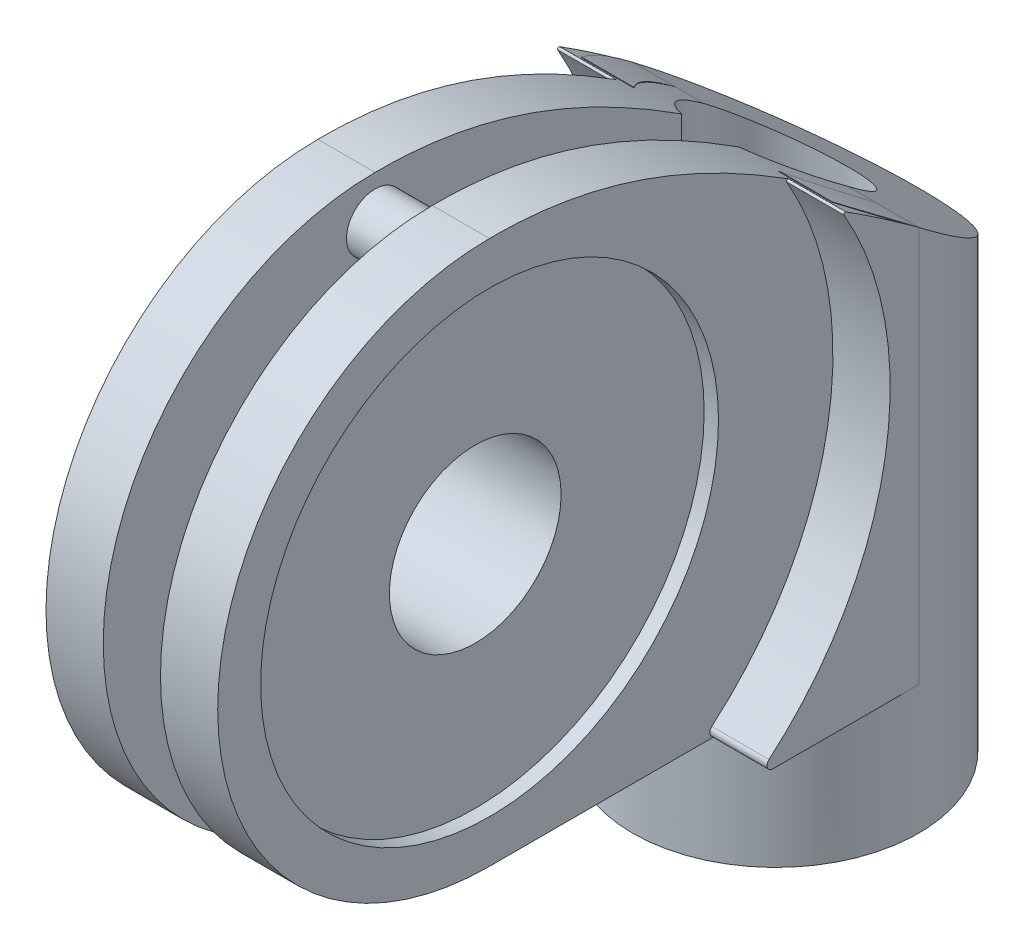
from build123d import *

# Parameters (mm, degrees)
SKETCH1_R                = 5
SKETCH1_R_2              = 3.5
BOSS_EXTRUDE1_DEPTH      = 20
BOSS_EXTRUDE2_DEPTH      = 5
BOSS_EXTRUDE2_DEPTH_BACK = 5
CUT_EXTRUDE1_DEPTH       = 11
SKETCH4_R                = 2.5
CUT_EXTRUDE2_DEPTH       = 22
SKETCH5_R                = 12
CUT_EXTRUDE3_DEPTH       = 2
CUT_EXTRUDE4_DEPTH       = 1
CUT_EXTRUDE4_DEPTH_BACK  = 1
SKETCH7_R                = 13
SKETCH8_R                = 3
CUT_EXTRUDE5_DEPTH       = 12
SKETCH9_R                = 8
CUT_EXTRUDE6_DEPTH       = 0.5
SKETCH10_R               = 1
BOSS_EXTRUDE3_DEPTH      = 2
FILLET2_R                = 0.2
FILLET3_R                = 0.05
CUT_EXTRUDE7_DEPTH       = 2.5
SKETCH13_R               = 4
SKETCH13_R_2             = 3
BOSS_EXTRUDE4_DEPTH      = 2


with BuildPart() as part:
    # Sketch1 → Boss-Extrude1 (new body)
    with BuildSketch(Plane(origin=(0, 0, 0), x_dir=(1, 0, 0), z_dir=(0, 1, 0))):
        with Locations(Location((0, 0, 0), (0, 0, 270))):
            Circle(SKETCH1_R)
        with Locations(Location((0, 0, 0), (0, 0, 270))):
            Circle(SKETCH1_R_2, mode=Mode.SUBTRACT)
    extrude(amount=BOSS_EXTRUDE1_DEPTH)

    # Sketch2 → Boss-Extrude2 (add, two sides: drawn at the far end of the back side and taken through both)
    with BuildSketch(Plane(origin=(0, 0, 0), x_dir=(0, 0, -1), z_dir=(1, 0, 0)).offset(-BOSS_EXTRUDE2_DEPTH_BACK)):
        with BuildLine():
            Line((-13, 4.5), (-5, 4.5))
            Line((-5, 4.5), (5, 4.5))
            Line((5, 4.5), (5, 14.523620686))
            add(Edge.make_bspline(
                [(-13, 23.5), (-5.796427923, 23.568793392), (-0.292647835, 18.508773454), (5, 14.523620686)],
                knots=[0, 0, 0, 0, 1, 1, 1, 1], degree=3))
            ThreePointArc((-13, 23.5), (-22.5, 14), (-13, 4.5))
        make_face()
    extrude(amount=BOSS_EXTRUDE2_DEPTH + BOSS_EXTRUDE2_DEPTH_BACK)

    # Sketch3 → Cut-Extrude1 (cut)
    with BuildSketch(Plane(origin=(5, 0, 0), x_dir=(0, 0, -1), z_dir=(1, 0, 0))):
        with BuildLine():
            Line((5, 14.523620686), (0, 18.334925008))
            ThreePointArc((0, 18.334925008), (-1.68076844, 19.533217124), (-3.434608276, 20.621763115))
            Line((-3.434608276, 20.621763115), (-1.011166378, 24.819921774))
            Line((-1.011166378, 24.819921774), (8.147058093, 19.533217127))
            Line((8.147058093, 19.533217127), (5, 14.523620686))
        make_face()
    extrude(amount=-CUT_EXTRUDE1_DEPTH, mode=Mode.SUBTRACT)

    # Sketch4 → Cut-Extrude2 (cut)
    with BuildSketch(Plane.XZ):
        with Locations(Location((0, 0, 0), (0, 0, 270))):
            Circle(SKETCH4_R)
        with BuildLine():
            Line((5, 0), (9.23044652, 0))
            ThreePointArc((9.23044652, 0), (0, -9.23044652), (-9.23044652, 0))
            Line((-9.23044652, 0), (-5, 0))
            ThreePointArc((-5, 0), (0, -5), (5, 0))
        make_face()
    extrude(amount=-CUT_EXTRUDE2_DEPTH, mode=Mode.SUBTRACT)


with BuildPart() as cut_extrude2_kept_piece:
    # of the separate pieces the step leaves, the one the design keeps (cut_extrude2_pieces_kept)
    add(part.part.solids().sort_by_distance((0, 4.5, 5))[0])

    # Sketch5 → Cut-Extrude3 (cut)
    with BuildSketch(Plane(origin=(5, 0, 0), x_dir=(0, 0, -1), z_dir=(1, 0, 0))):
        with Locations((-13, 14)):
            Circle(SKETCH5_R)
    cut_extrude3 = extrude(amount=-CUT_EXTRUDE3_DEPTH, mode=Mode.SUBTRACT)

    # Mirror1: Cut-Extrude3 across plane
    add(cut_extrude3.mirror(Plane(origin=(0, 0, 0), x_dir=(0, 0, 1), z_dir=(1, 0, 0))), mode=Mode.SUBTRACT)

    # Sketch7 → Cut-Extrude4 (cut, two sides: drawn at the far end of the back side and taken through both)
    with BuildSketch(Plane(origin=(0, 0, 0), x_dir=(0, 0, -1), z_dir=(1, 0, 0)).offset(-CUT_EXTRUDE4_DEPTH_BACK)):
        with Locations((-13, 14)):
            Circle(SKETCH7_R)
    extrude(amount=CUT_EXTRUDE4_DEPTH + CUT_EXTRUDE4_DEPTH_BACK, mode=Mode.SUBTRACT)

    # Sketch8 → Cut-Extrude5 (cut)
    with BuildSketch(Plane(origin=(3, 0, 0), x_dir=(0, 0, -1), z_dir=(1, 0, 0))):
        with Locations((-13, 14)):
            Circle(SKETCH8_R)
    extrude(amount=-CUT_EXTRUDE5_DEPTH, mode=Mode.SUBTRACT)

    # Sketch9 → Cut-Extrude6 (cut)
    with BuildSketch(Plane(origin=(3, 0, 0), x_dir=(0, 0, -1), z_dir=(1, 0, 0))):
        with Locations((-13, 14)):
            Circle(SKETCH9_R)
    cut_extrude6 = extrude(amount=-CUT_EXTRUDE6_DEPTH, mode=Mode.SUBTRACT)

    # Mirror2: Cut-Extrude6 across plane
    add(cut_extrude6.mirror(Plane(origin=(0, 0, 0), x_dir=(0, 0, 1), z_dir=(1, 0, 0))), mode=Mode.SUBTRACT)

    # Sketch10 → Boss-Extrude3 (add)
    with BuildSketch(Plane.ZY.offset(-1)):
        with Locations(Location((13, 22, 0), (0, 0, 180))):
            Circle(SKETCH10_R)
    extrude(amount=BOSS_EXTRUDE3_DEPTH)

    # Fillet2
    fillet2_edges = [cut_extrude2_kept_piece.edges().sort_by_distance(p)[0] for p in [
        (4, 4.5, 5.668560851),
        (-4, 4.5, 5.668560851),
    ]]
    fillet(fillet2_edges, radius=FILLET2_R)

    # Fillet3
    fillet3_edges = [cut_extrude2_kept_piece.edges().sort_by_distance(p)[0] for p in [
        (4, 20.186157732, 2.717419949),
        (-4, 20.186157732, 2.717419949),
    ]]
    fillet(fillet3_edges, radius=FILLET3_R)

    # Sketch12 → Cut-Extrude7 (cut)
    with BuildSketch(Plane.XY.offset(-5)):
        Polygon((0, 0), (0.5, 0), (0.5, 1), (-0.5, 1), (-0.5, 0), align=None)
    extrude(amount=CUT_EXTRUDE7_DEPTH, mode=Mode.SUBTRACT)

    # Sketch13 → Boss-Extrude4 (add)
    with BuildSketch(Plane.ZY.offset(-1)):
        with Locations(Location((13, 14, 0), (0, 0, 180))):
            Circle(SKETCH13_R)
        with Locations(Location((13, 14, 0), (0, 0, 180))):
            Circle(SKETCH13_R_2, mode=Mode.SUBTRACT)
    extrude(amount=BOSS_EXTRUDE4_DEPTH)


solid = cut_extrude2_kept_piece.part
